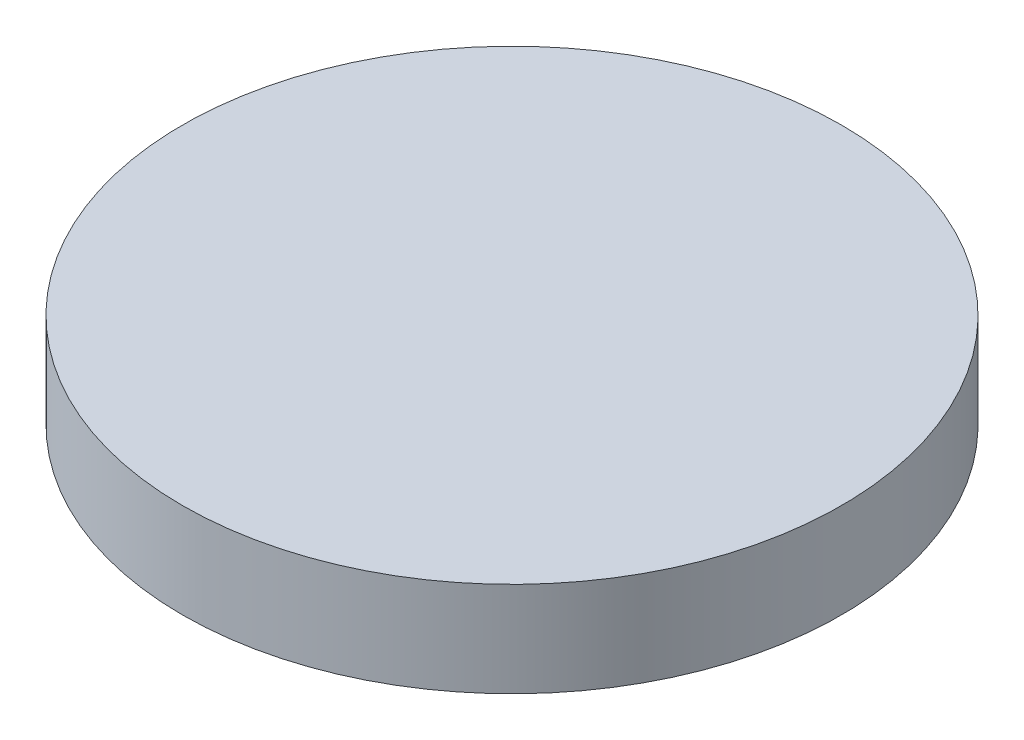
from build123d import *

# Parameters (mm, degrees)
SKETCH1_R           = 11.2
BOSS_EXTRUDE1_DEPTH = 3.22


with BuildPart() as part:
    # Sketch1 → Boss-Extrude1 (new body)
    with BuildSketch(Plane(origin=(0, 0, 0), x_dir=(1, 0, 0), z_dir=(0, 1, 0))):
        with Locations(Location((0, 0, 0), (0, 0, 270))):
            Circle(SKETCH1_R)
    extrude(amount=-BOSS_EXTRUDE1_DEPTH)


solid = part.part
